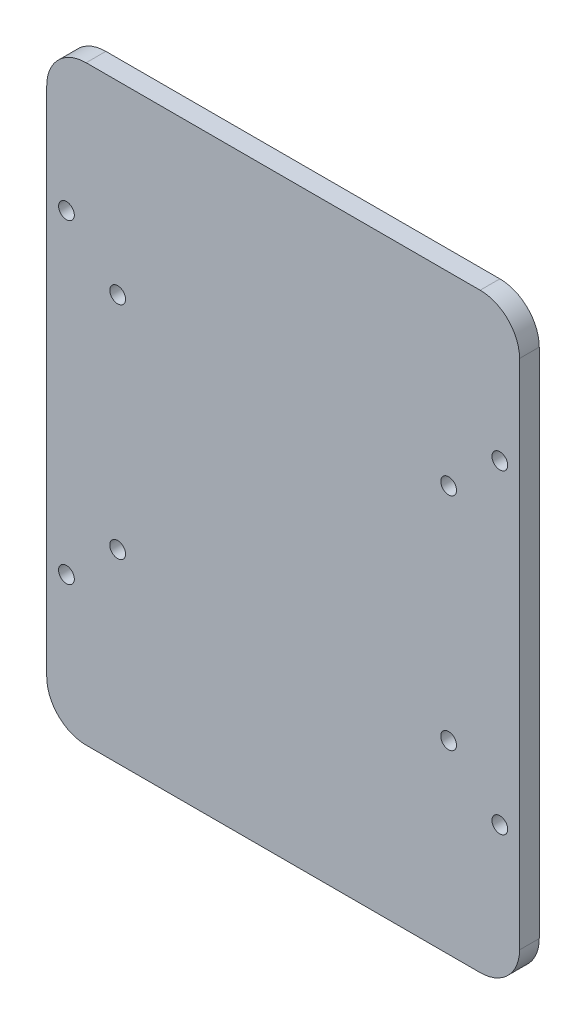
from build123d import *

# Parameters (mm, degrees)
SKETCH_1_W               = 120
SKETCH_1_H               = 150
EXTRUDE_1_DEPTH          = 5
FILLET_1_R               = 10
SKETCH_2_R               = 2
CUT_EXTRUDE_1_DEPTH      = 10
MIRROR_2_COPY_1_SKETCH_R = 2
MIRROR_2_COPY_1_DEPTH    = 10


with BuildPart() as part:
    # 草图1 → 凸台-拉伸1 (new body)
    with BuildSketch(Plane.XY):
        with Locations((60, 75)):
            Rectangle(SKETCH_1_W, SKETCH_1_H)
    extrude(amount=EXTRUDE_1_DEPTH)

    # 圆角1
    fillet_1_edges = [part.edges().sort_by_distance(p)[0] for p in [
        (0, 0, 2.5),
        (0, 150, 2.5),
        (120, 150, 2.5),
        (120, 0, 2.5),
    ]]
    fillet(fillet_1_edges, radius=FILLET_1_R)

    # 草图2 → 切除-拉伸1 (cut)
    with BuildSketch(Plane.XY.offset(5)):
        with Locations((18, 47)):
            Circle(SKETCH_2_R)
        with Locations((5, 35)):
            Circle(SKETCH_2_R)
    cut_extrude_1 = extrude(amount=-CUT_EXTRUDE_1_DEPTH, mode=Mode.SUBTRACT)

    # 镜向1: 切除-拉伸1 across plane
    add(cut_extrude_1.mirror(Plane(origin=(0, 75, 0), x_dir=(0, 0, 1), z_dir=(0, -1, 0))), mode=Mode.SUBTRACT)

    # 镜向2: 切除-拉伸1 across plane
    add(cut_extrude_1.mirror(Plane.ZY.offset(-60)), mode=Mode.SUBTRACT)

    # 镜向2 copy 1 sketch → 镜向2 copy 1 (cut)
    with BuildSketch(Plane(origin=(120, 150, 5), x_dir=(-1, 0, 0), z_dir=(0, 0, 1))):
        with Locations((18, 47)):
            Circle(MIRROR_2_COPY_1_SKETCH_R)
        with Locations((5, 35)):
            Circle(MIRROR_2_COPY_1_SKETCH_R)
    extrude(amount=-MIRROR_2_COPY_1_DEPTH, mode=Mode.SUBTRACT)


solid = part.part
